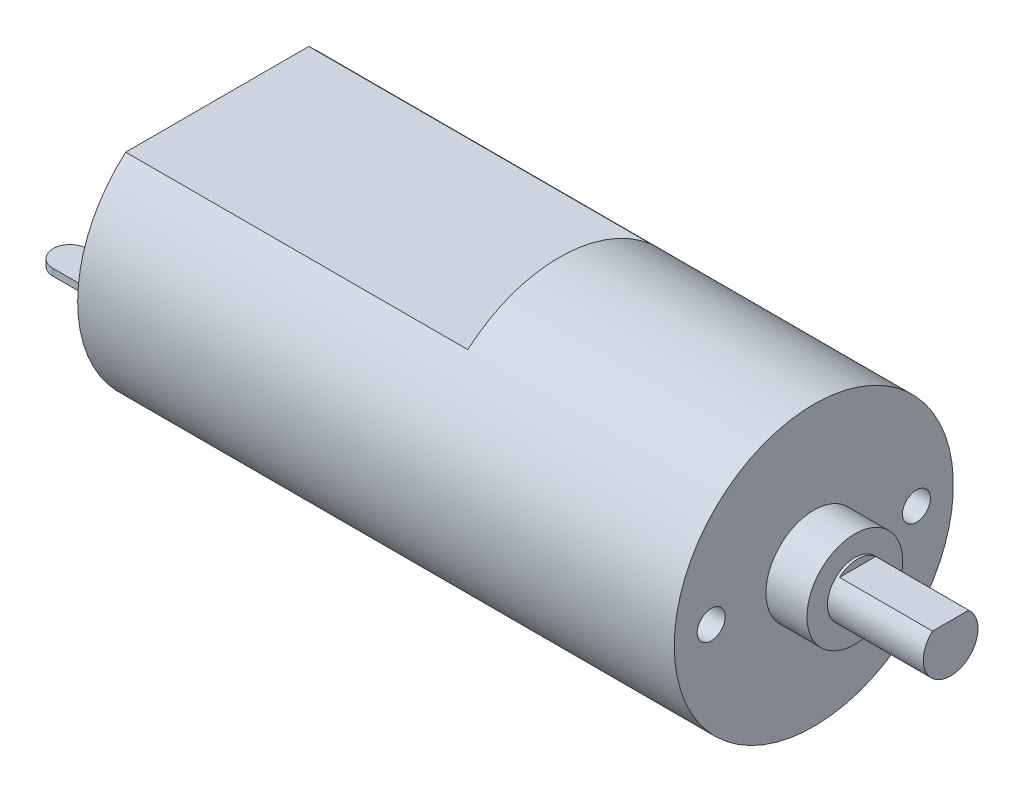
from build123d import *

# Parameters (mm, degrees)
CUT_EXTRUDE1_START           = -6.8
CUT_EXTRUDE1_DEPTH           = 6.8
CUT_EXTRUDE2_DEPTH           = 25
M2_5X0_45_TAPPED_HOLE1_D     = 2.05
M2_5X0_45_TAPPED_HOLE1_DEPTH = 6.35
M2_5X0_45_TAPPED_HOLE1_TIP   = 0.615882135
BOSS_EXTRUDE1_DEPTH          = 0.25
SKETCH8_R                    = 3
BOSS_EXTRUDE2_DEPTH          = 2


with BuildPart() as part:
    # Sketch1 → Revolve1 (revolve)
    with BuildSketch(Plane.XY, mode=Mode.PRIVATE) as revolve1_sk:
        Polygon((-26.8, 0), (26.8, 0), (26.8, 2), (19.8, 2), (19.8, 3.5), (16.8, 3.5), (16.8, 10.2), (-26.8, 10.2), align=None)
    revolve(revolve1_sk.sketch.rotate(Axis((-26.8, 0, 0), (1, 0, 0)), 90), axis=Axis((-26.8, 0, 0), (1, 0, 0)))

    # Sketch3 → Cut-Extrude1 (cut)
    with BuildSketch(Plane(origin=(26.8, 0, 0), x_dir=(0, 0, -1), z_dir=(1, 0, 0)).offset(CUT_EXTRUDE1_START)):
        with BuildLine():
            Line((-1.322875656, 1.5), (1.322875656, 1.5))
            ThreePointArc((1.322875656, 1.5), (0, 2), (-1.322875656, 1.5))
        make_face()
    extrude(amount=CUT_EXTRUDE1_DEPTH, mode=Mode.SUBTRACT)

    # Sketch4 → Cut-Extrude2 (cut)
    with BuildSketch(Plane.ZY.offset(26.8)):
        with BuildLine():
            Line((-6.68954408, 7.7), (6.68954408, 7.7))
            ThreePointArc((6.68954408, 7.7), (0, 10.2), (-6.68954408, 7.7))
        make_face()
        with BuildLine():
            Line((-6.68954408, -7.7), (6.68954408, -7.7))
            ThreePointArc((6.68954408, -7.7), (0, -10.2), (-6.68954408, -7.7))
        make_face()
    extrude(amount=-CUT_EXTRUDE2_DEPTH, mode=Mode.SUBTRACT)

    # M2.5x0.45 Tapped Hole1
    with Locations(Plane(origin=(16.8, 0, 0), x_dir=(0, 0, -1), z_dir=(1, 0, 0))):
        with Locations((-7.5, 0), (7.5, 0)):
            Hole(M2_5X0_45_TAPPED_HOLE1_D / 2, depth=M2_5X0_45_TAPPED_HOLE1_DEPTH)
            with Locations((0, 0, -(M2_5X0_45_TAPPED_HOLE1_DEPTH + M2_5X0_45_TAPPED_HOLE1_TIP / 2))):  # 118° drill point
                Cone(0, M2_5X0_45_TAPPED_HOLE1_D / 2, M2_5X0_45_TAPPED_HOLE1_TIP, mode=Mode.SUBTRACT)

    # Sketch7 → Boss-Extrude1 (add, symmetric)
    with BuildSketch(Plane(origin=(0, 0, 0), x_dir=(1, 0, 0), z_dir=(0, 1, 0))):
        with BuildLine():
            Line((-26.8, 9.25), (-29.55, 9.25))
            ThreePointArc((-29.55, 9.25), (-30.8, 8), (-29.55, 6.75))
            Line((-29.55, 6.75), (-26.8, 6.75))
            Line((-26.8, 6.75), (-26.8, 9.25))
        make_face()
        with BuildLine():
            Line((-26.8, -6.75), (-26.8, -9.25))
            Line((-26.8, -9.25), (-29.55, -9.25))
            ThreePointArc((-29.55, -9.25), (-30.8, -8), (-29.55, -6.75))
            Line((-29.55, -6.75), (-26.8, -6.75))
        make_face()
    extrude(amount=BOSS_EXTRUDE1_DEPTH, both=True)

    # Sketch8 → Boss-Extrude2 (add)
    with BuildSketch(Plane.ZY.offset(26.8)):
        with Locations(Location((0, 0, 0), (0, 0, 180))):
            Circle(SKETCH8_R)
    extrude(amount=BOSS_EXTRUDE2_DEPTH)


solid = part.part
